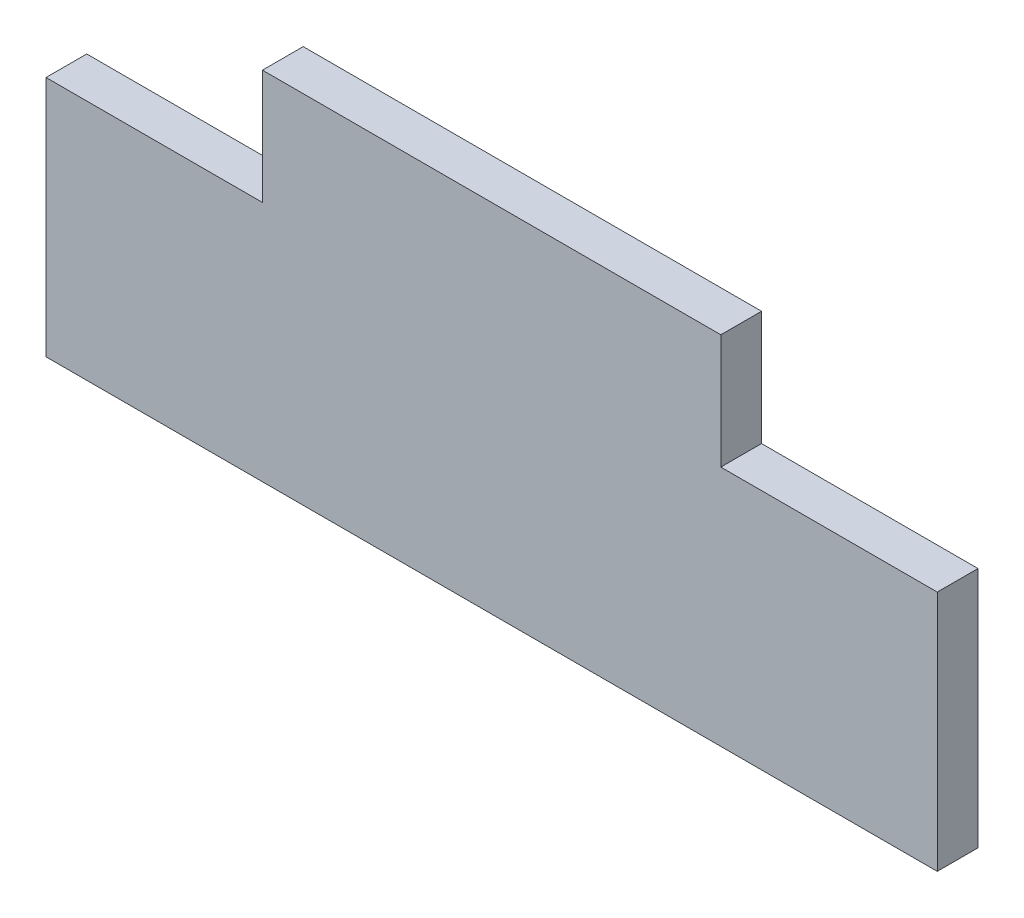
from build123d import *

# Parameters (mm, degrees)
BOSS_EXTRUDE1_DEPTH = 1.6


with BuildPart() as part:
    # Sketch1 → Boss-Extrude1 (new body)
    with BuildSketch(Plane.XY):
        Polygon((0, 0), (35, 0), (35, 9.5), (26.5, 9.5), (26.5, 14), (8.5, 14), (8.5, 9.5), (0, 9.5), align=None)
    extrude(amount=BOSS_EXTRUDE1_DEPTH)


solid = part.part
